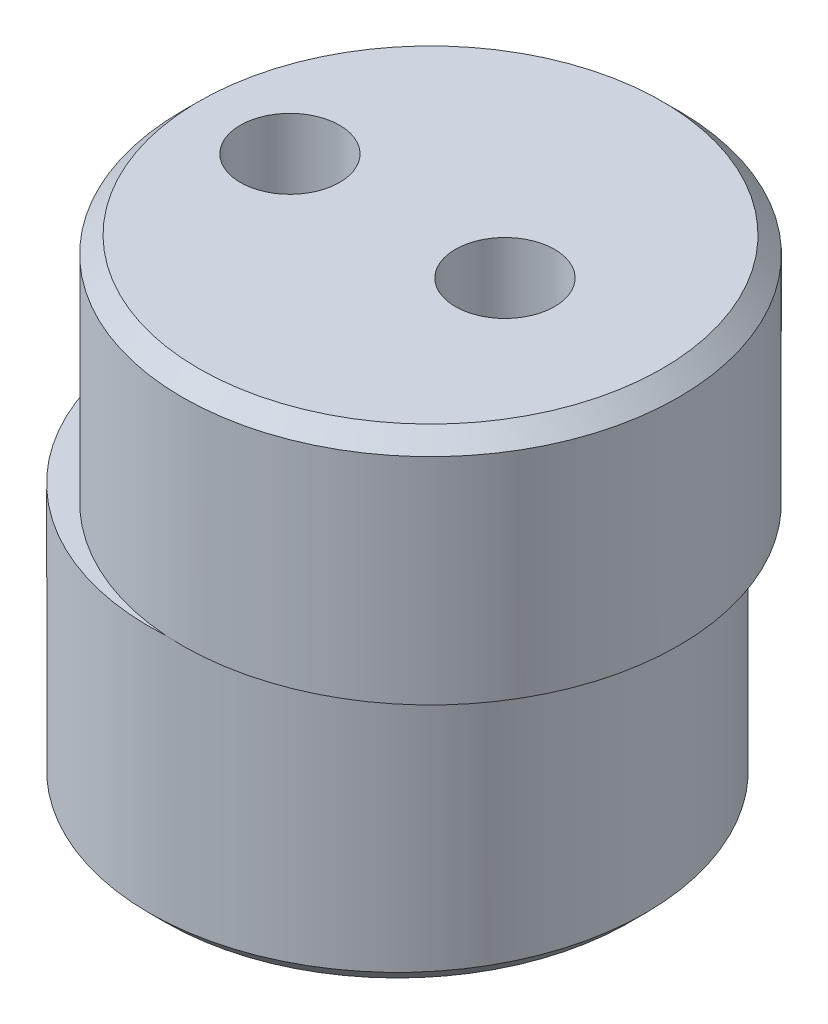
from build123d import *

# Parameters (mm, degrees)
SKETCH1_R           = 7.5
BOSS_EXTRUDE1_DEPTH = 8
SKETCH2_R           = 7.5
BOSS_EXTRUDE2_DEPTH = 7
SKETCH3_R           = 1.5
CUT_EXTRUDE1_DEPTH  = 19.801595677
CHAMFER1_SIZE       = 0.5


with BuildPart() as part:
    # Sketch1 → Boss-Extrude1 (new body)
    with BuildSketch(Plane(origin=(0, 0, 0), x_dir=(1, 0, 0), z_dir=(0, 1, 0))):
        with Locations(Location((0, 0, 0), (0, 0, 270))):
            Circle(SKETCH1_R)
    extrude(amount=BOSS_EXTRUDE1_DEPTH)

    # Sketch2 → Boss-Extrude2 (add)
    with BuildSketch(Plane(origin=(0, 8, 0), x_dir=(1, 0, 0), z_dir=(0, 1, 0))):
        with Locations(Location((1, 0, 0), (0, 0, 93.822553729))):
            Circle(SKETCH2_R)
    extrude(amount=BOSS_EXTRUDE2_DEPTH)

    # Sketch3 → Cut-Extrude1 (cut, through all)
    with BuildSketch(Plane.XZ):
        with Locations(Location((-3.25, 0, 0), (0, 0, 270))):
            Circle(SKETCH3_R)
        with Locations(Location((3.25, 0, 0), (0, 0, 270))):
            Circle(SKETCH3_R)
    extrude(amount=-CUT_EXTRUDE1_DEPTH, mode=Mode.SUBTRACT)

    # Chamfer1
    chamfer1_edges = [part.edges().sort_by_distance(p)[0] for p in [
        (0, 0, -7.5),
        (1.5, 15, 7.483314774),
    ]]
    chamfer(chamfer1_edges, length=CHAMFER1_SIZE)


solid = part.part
